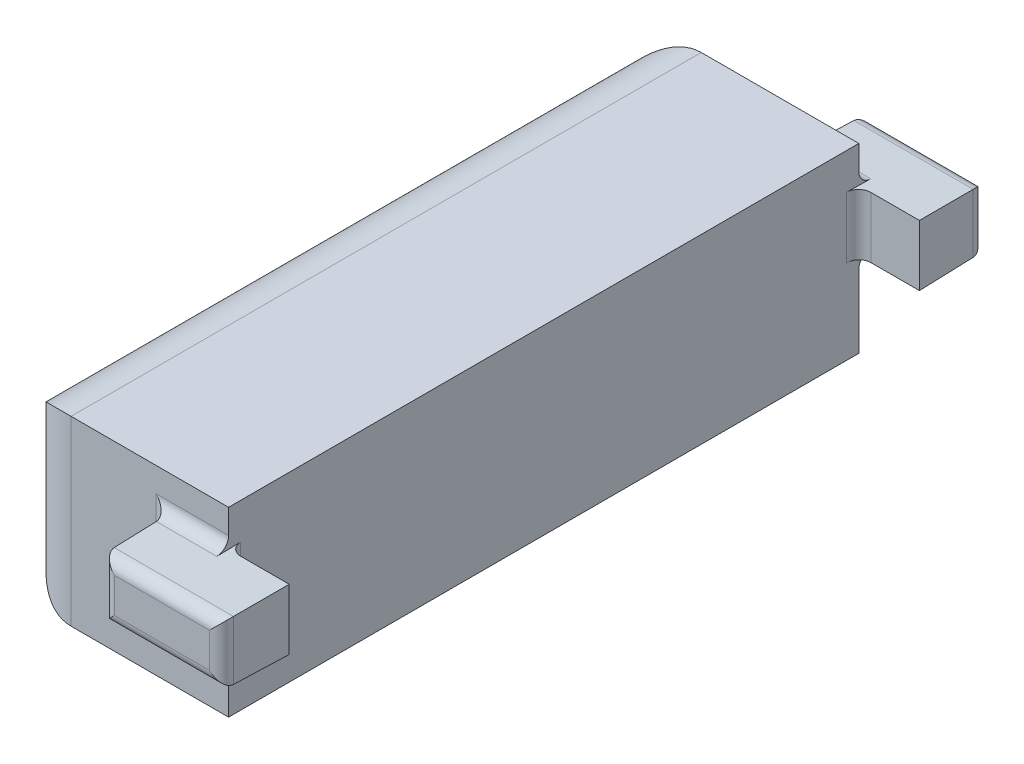
from build123d import *

# Parameters (mm, degrees)
BOSS_EXTRUDE1_DEPTH      = 0.5
BOSS_EXTRUDE1_DEPTH_BACK = 1.3
SKETCH2_W                = 5.2
SKETCH2_H                = 1.5
SKETCH3_W                = 1
SKETCH3_H                = 0.501837325
BOSS_EXTRUDE2_DEPTH      = 0.55
BOSS_EXTRUDE2_TAPER      = 1
FILLET1_R                = 0.1
FILLET2_R                = 0.1
FILLET3_R                = 0.5


with BuildPart() as part:
    # Sketch2 → Boss-Extrude1 (new, two sides: drawn at the far end of the back side and taken through both)
    with BuildSketch(Plane(origin=(-12.65, 0, 0), x_dir=(0, 0, -1), z_dir=(1, 0, 0)).offset(-BOSS_EXTRUDE1_DEPTH_BACK)):
        with Locations((58.5, 2.75)):
            Rectangle(SKETCH2_W, SKETCH2_H)
    extrude(amount=BOSS_EXTRUDE1_DEPTH + BOSS_EXTRUDE1_DEPTH_BACK)

    # Sketch3 → Boss-Extrude2 (add)
    with BuildSketch(Plane.XY.offset(-55.9)):
        with Locations((-12.15, 2.949081338)):
            Rectangle(SKETCH3_W, SKETCH3_H)
    boss_extrude2 = extrude(amount=BOSS_EXTRUDE2_DEPTH, taper=BOSS_EXTRUDE2_TAPER)

    # Mirror1: Boss-Extrude2 across plane
    add(boss_extrude2.mirror(Plane.XY.offset(-58.5)))

    # Fillet1
    fillet1_edges = [part.edges().sort_by_distance(p)[0] for p in [
        (-12.4, 3.2, -55.9),
        (-12.65, 2.949081337, -55.9),
        (-12.4, 2.698162675, -55.9),
        (-11.659600286, 2.949081337, -55.35),
        (-12.15, 3.190399714, -55.35),
        (-12.640399714, 2.949081337, -55.35),
        (-12.15, 2.707762961, -55.35),
        (-12.4, 3.2, -61.1),
        (-11.659600286, 2.949081337, -61.65),
        (-12.15, 2.707762961, -61.65),
        (-12.640399714, 2.949081337, -61.65),
        (-12.15, 3.190399714, -61.65),
        (-12.4, 2.698162675, -61.1),
        (-12.65, 2.949081337, -61.1),
    ]]
    fillet(fillet1_edges, radius=FILLET1_R)

    # Fillet2
    fillet2_edges = [part.edges().sort_by_distance(p)[0] for p in [
        (-12.15, 2.949081337, -55.9),
        (-12.15, 2.949081337, -61.1),
    ]]
    fillet(fillet2_edges, radius=FILLET2_R)

    # Fillet3
    fillet3_edges = [part.edges().sort_by_distance(p)[0] for p in [
        (-13.95, 2.75, -55.9),
        (-13.95, 3.5, -58.5),
        (-13.95, 2.75, -61.1),
        (-13.95, 2, -58.5),
    ]]
    fillet(fillet3_edges, radius=FILLET3_R)


solid = part.part
